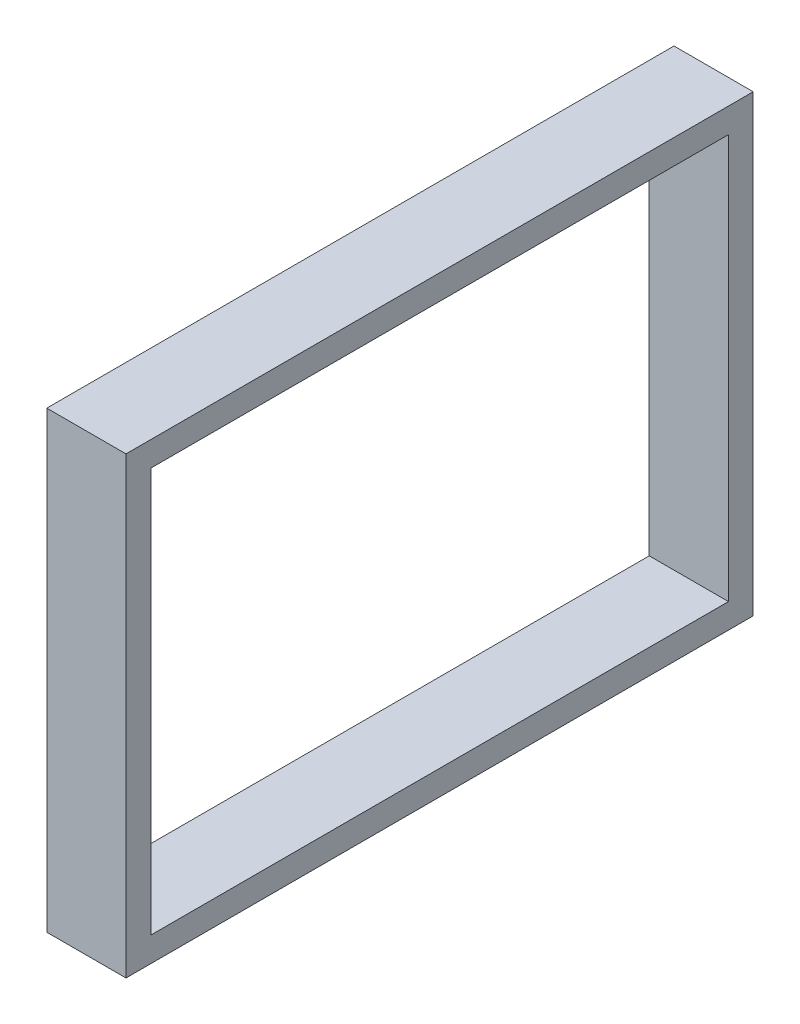
from build123d import *

# Parameters (mm, degrees)
SKETCH_1_W        = 38
SKETCH_1_H        = 27.5
SKETCH_1_W_2      = 35
SKETCH_1_H_2      = 24.5
EXTRUDE_576_DEPTH = 2.4


with BuildPart() as part:
    # ｽｹｯﾁ1 → Extrude 576 (new, symmetric)
    with BuildSketch(Plane(origin=(0, 0, 0), x_dir=(0, 0, -1), z_dir=(1, 0, 0))):
        with Locations((-12.5, 0)):
            Rectangle(SKETCH_1_W, SKETCH_1_H)
        with Locations((-12.5, 0)):
            Rectangle(SKETCH_1_W_2, SKETCH_1_H_2, mode=Mode.SUBTRACT)
    extrude(amount=EXTRUDE_576_DEPTH, both=True)


solid = part.part
